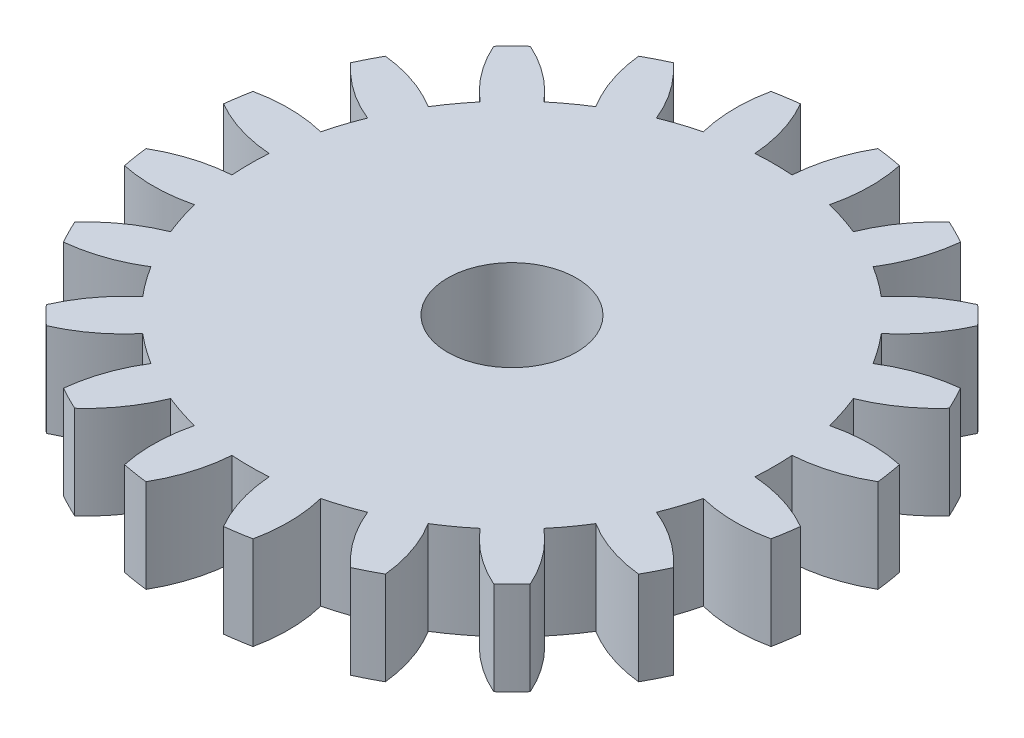
from build123d import *

# Parameters (mm, degrees)
SKETCH1_R           = 8.255
BOSS_EXTRUDE1_DEPTH = 2.3368
SKETCH2_R           = 1.6129
CUT_EXTRUDE1_DEPTH  = 12.905909635
CUT_EXTRUDE6_DEPTH  = 12.905909635
CIRPATTERN1_COUNT   = 20


with BuildPart() as part:
    # Sketch1 → Boss-Extrude1 (new body)
    with BuildSketch(Plane(origin=(0, 0, 0), x_dir=(1, 0, 0), z_dir=(0, 1, 0))):
        with Locations(Location((0, 0, 0), (0, 0, 270))):
            Circle(SKETCH1_R)
    extrude(amount=BOSS_EXTRUDE1_DEPTH)

    # Sketch2 → Cut-Extrude1 (cut, through all)
    with BuildSketch(Plane(origin=(0, 2.3368, 0), x_dir=(1, 0, 0), z_dir=(0, 1, 0))):
        with Locations(Location((0, 0, 0), (0, 0, 270))):
            Circle(SKETCH2_R)
    extrude(amount=-CUT_EXTRUDE1_DEPTH, mode=Mode.SUBTRACT)

    # Sketch3 → Cut-Extrude6 (cut, through all)
    with BuildSketch(Plane(origin=(0, 2.3368, 0), x_dir=(1, 0, 0), z_dir=(0, 1, 0))):
        with BuildLine():
            Line((1.426333388, 8.827371755), (-1.426333388, 8.827371755))
            ThreePointArc((-1.426333388, 8.827371755), (-0.757299678, 7.767926416), (-0.465480831, 6.549373056))
            ThreePointArc((-0.465480831, 6.549373056), (0, 6.565893681), (0.465480831, 6.549373056))
            ThreePointArc((0.465480831, 6.549373056), (0.757299678, 7.767926416), (1.426333388, 8.827371755))
        make_face()
    cut_extrude6 = extrude(amount=-CUT_EXTRUDE6_DEPTH, mode=Mode.SUBTRACT)

    # CirPattern1: Cut-Extrude6 ×20 about axis
    cirpattern1_axis = Axis((0, 0, 0), (0, 1, 0))
    for i in range(1, CIRPATTERN1_COUNT):
        add(cut_extrude6.rotate(cirpattern1_axis, i * 360 / CIRPATTERN1_COUNT), mode=Mode.SUBTRACT)


solid = part.part
